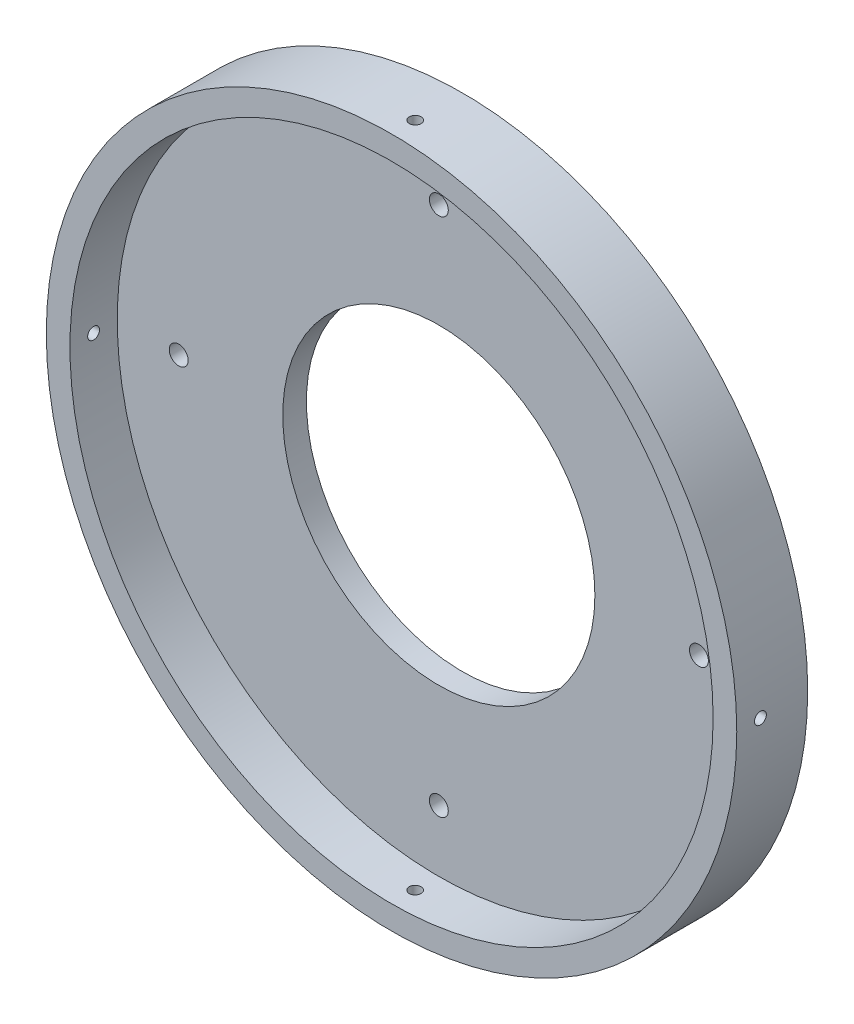
from build123d import *

# Parameters (mm, degrees)
SKETCH1_R               = 73
SKETCH1_R_2             = 33
BOSS_EXTRUDE1_DEPTH     = 5
SKETCH2_R               = 73
SKETCH2_R_2             = 68
BOSS_EXTRUDE2_DEPTH     = 10
CUT_EXTRUDE1_REACH      = 106.322
CUT_EXTRUDE1_END_RADIUS = 73
SKETCH3_R               = 1.25
CIRPATTERN1_COUNT       = 4
F_4_0MM_DOWEL_HOLE1_D   = 4


with BuildPart() as part:
    # Sketch1 → Boss-Extrude1 (new body)
    with BuildSketch(Plane.XY):
        Circle(SKETCH1_R)
        Circle(SKETCH1_R_2, mode=Mode.SUBTRACT)
    extrude(amount=BOSS_EXTRUDE1_DEPTH)

    # Sketch2 → Boss-Extrude2 (add)
    with BuildSketch(Plane.XY.offset(5)):
        Circle(SKETCH2_R)
        Circle(SKETCH2_R_2, mode=Mode.SUBTRACT)
    extrude(amount=BOSS_EXTRUDE2_DEPTH)

    # Cut-Extrude1: up to this cylinder (the profile starts inside it)
    cut_extrude1_end = Plane(origin=(0, 0, 10), z_dir=(0, 0, -1)) * Cylinder(CUT_EXTRUDE1_END_RADIUS, 359.644, mode=Mode.PRIVATE)
    # Sketch3 → Cut-Extrude1 (cut, up to the surface)
    with BuildSketch(Plane(origin=(0, 0, 0), x_dir=(1, 0, 0), z_dir=(0, 1, 0)), mode=Mode.PRIVATE) as cut_extrude1_sk1:
        with Locations(Location((0, -10, 0), (0, 0, 270))):
            Circle(SKETCH3_R)
    cut_extrude1_tool1 = extrude(cut_extrude1_sk1.sketch, amount=-CUT_EXTRUDE1_REACH, mode=Mode.PRIVATE) & cut_extrude1_end
    cut_extrude1 = cut_extrude1_tool1.solids().sort_by_distance((0, 0, 10))[0]
    add(cut_extrude1, mode=Mode.SUBTRACT)

    # CirPattern1: Cut-Extrude1 ×4 about axis
    cirpattern1_axis = Axis((0, 0, 5), (0, 0, -1))
    for i in range(1, CIRPATTERN1_COUNT):
        add(cut_extrude1.rotate(cirpattern1_axis, i * 360 / CIRPATTERN1_COUNT), mode=Mode.SUBTRACT)

    # Ø4.0mm Dowel Hole1 (through all)
    with Locations(Plane(origin=(0, 0, 0), x_dir=(-1, 0, 0), z_dir=(0, 0, -1))):
        with Locations((0, 55), (55, 0), (0, -55), (-55, 0)):
            Hole(F_4_0MM_DOWEL_HOLE1_D / 2)


solid = part.part
